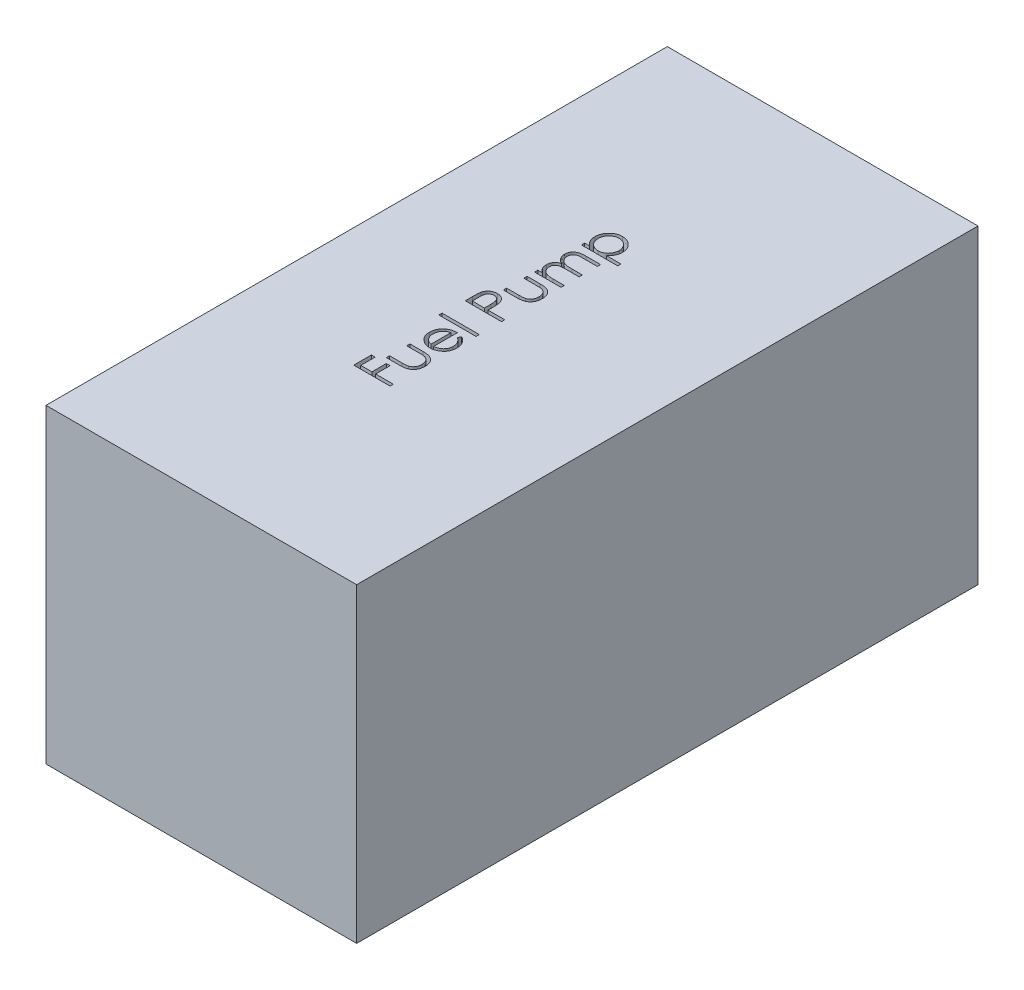
from build123d import *

# Parameters (mm, degrees)
SKETCH1_W           = 30
SKETCH1_H           = 60
BOSS_EXTRUDE1_DEPTH = 30
SKETCH2_W           = 3.58974359
SKETCH2_H           = 0.314102565
CUT_EXTRUDE1_DEPTH  = 2


with BuildPart() as part:
    # Sketch1 → Boss-Extrude1 (new body)
    with BuildSketch(Plane(origin=(0, 0, 0), x_dir=(1, 0, 0), z_dir=(0, 1, 0))):
        Rectangle(SKETCH1_W, SKETCH1_H)
    extrude(amount=BOSS_EXTRUDE1_DEPTH)

    # Sketch2 → Cut-Extrude1 (cut)
    # profile 1 of 8: a face of its own
    with BuildSketch(Plane(origin=(0, 30, 0), x_dir=(1, 0, 0), z_dir=(0, 1, 0))):
        Polygon((-3.5, -11.778846154), (-3.5, -10.073717949), (-3.141025641, -10.073717949), (-3.141025641, -11.46474359), (-2.064102564, -11.46474359), (-2.064102564, -10.073717949), (-1.705128205, -10.073717949), (-1.705128205, -11.46474359), (0, -11.46474359), (0, -11.778846154), align=None)
    # profile 2 of 8: a face of its own
    with BuildSketch(Plane(origin=(0, 30, 0), x_dir=(1, 0, 0), z_dir=(0, 1, 0))):
        with BuildLine():
            Line((-2.557692308, -9.580128205), (-2.557692308, -9.266025641))
            Line((-2.557692308, -9.266025641), (-1.371394231, -9.266025641))
            add(Edge.make_bspline(
                [(-1.371394231, -9.266025641), (-1.336571482, -9.265883736), (-1.269957194, -9.265612279), (-1.174102007, -9.263771338), (-1.086685294, -9.259441244), (-1.007656557, -9.25402742), (-0.937029166, -9.247065284), (-0.875049809, -9.238781923), (-0.821015625, -9.229523501), (-0.788472269, -9.220460787), (-0.77333734, -9.216245994)],
                knots=[0, 0, 0, 0, 1.388932606, 2.656963016, 3.823490214, 4.879454478, 5.816252168, 6.653371382, 7.373723809, 8, 8, 8, 8], degree=3))
            add(Edge.make_bspline(
                [(-0.77333734, -9.216245994), (-0.754314469, -9.209484539), (-0.716664208, -9.196102198), (-0.662275202, -9.171828714), (-0.61189992, -9.141800377), (-0.563595847, -9.108940549), (-0.51879386, -9.071041142), (-0.477569617, -9.028581671), (-0.438365526, -8.982983434), (-0.391980734, -8.91522841), (-0.342265403, -8.822569144), (-0.299369585, -8.700916389), (-0.273733765, -8.569012163), (-0.27075951, -8.477847444), (-0.269230769, -8.430989583)],
                knots=[0, 0, 0, 0, 0.725840625, 1.436591201, 2.137033971, 2.831655856, 3.53531722, 4.242432219, 4.957935707, 5.694543706, 7.190802206, 8.724350549, 10.316345118, 12, 12, 12, 12], degree=3))
            add(Edge.make_bspline(
                [(-0.269230769, -8.430989583), (-0.270792018, -8.384136076), (-0.273812745, -8.293483207), (-0.298596284, -8.163028238), (-0.340001973, -8.043776824), (-0.397809384, -7.936925872), (-0.468551447, -7.842960032), (-0.551560256, -7.764655613), (-0.644209643, -7.700048359), (-0.713333922, -7.671838938), (-0.748096955, -7.657652244)],
                knots=[0, 0, 0, 0, 1.157059328, 2.238695713, 3.266970494, 4.264342957, 5.228770407, 6.160125903, 7.074715775, 8, 8, 8, 8], degree=3))
            add(Edge.make_bspline(
                [(-0.748096955, -7.657652244), (-0.762063254, -7.653458014), (-0.792939329, -7.644185595), (-0.845319078, -7.634223244), (-0.907783682, -7.625248782), (-0.980741891, -7.617585606), (-1.064003043, -7.612120443), (-1.157541119, -7.609174417), (-1.26106248, -7.605846142), (-1.333530239, -7.605795625), (-1.371394231, -7.605769231)],
                knots=[0, 0, 0, 0, 0.557542046, 1.232589297, 2.036731608, 2.971723315, 4.038036528, 5.22795436, 6.551621927, 8, 8, 8, 8], degree=3))
            Line((-1.371394231, -7.605769231), (-2.557692308, -7.605769231))
            Line((-2.557692308, -7.605769231), (-2.557692308, -7.291666667))
            Line((-2.557692308, -7.291666667), (-1.3125, -7.291666667))
            add(Edge.make_bspline(
                [(-1.3125, -7.291666667), (-1.270193064, -7.292109949), (-1.188111822, -7.292969976), (-1.068824502, -7.298455731), (-0.957442487, -7.307999326), (-0.854306526, -7.322110744), (-0.759392664, -7.339230604), (-0.672668679, -7.360876252), (-0.594021821, -7.386867957), (-0.522278152, -7.416169037), (-0.457236046, -7.450796165), (-0.395483334, -7.487606735), (-0.338652658, -7.530191556), (-0.283669926, -7.574635995), (-0.234378406, -7.625237578), (-0.186871763, -7.678103549), (-0.144191351, -7.736140561), (-0.104921928, -7.79766401), (-0.069707159, -7.863253381), (-0.038720643, -7.932749084), (-0.012916197, -8.006431077), (0.008115437, -8.084272146), (0.024914963, -8.165969545), (0.036677563, -8.251688957), (0.043909547, -8.341353275), (0.04454566, -8.402463056), (0.044871795, -8.433794071)],
                knots=[0, 0, 0, 0, 1.493202592, 2.897017285, 4.213619731, 5.437335819, 6.569830554, 7.616136122, 8.589086983, 9.491357706, 10.347307, 11.187612773, 12.025729508, 12.851620453, 13.679855991, 14.515574443, 15.358588344, 16.218977568, 17.089938093, 17.983570823, 18.901874366, 19.842360053, 20.827541903, 21.843594624, 22.894409941, 24, 24, 24, 24], degree=3))
            add(Edge.make_bspline(
                [(0.044871795, -8.433794071), (0.044532563, -8.46489075), (0.043865941, -8.52599862), (0.036717408, -8.615667522), (0.024933365, -8.701624533), (0.007992445, -8.783515079), (-0.01276337, -8.861669227), (-0.038879827, -8.935707544), (-0.069703446, -9.005723525), (-0.104768555, -9.071867815), (-0.144263669, -9.133920969), (-0.187732462, -9.191743513), (-0.234040785, -9.246366275), (-0.284767972, -9.296272997), (-0.339534233, -9.341829725), (-0.398093467, -9.383233962), (-0.45978383, -9.421193883), (-0.525848019, -9.455545787), (-0.598419733, -9.485057798), (-0.678716919, -9.511112967), (-0.767619409, -9.532423629), (-0.865051346, -9.54976609), (-0.970546385, -9.563717533), (-1.084714801, -9.573403674), (-1.207278493, -9.578819505), (-1.291928383, -9.579682567), (-1.335637019, -9.580128205)],
                knots=[0, 0, 0, 0, 1.083759936, 2.129689164, 3.133164553, 4.10615121, 5.04285688, 5.949793092, 6.839814394, 7.707177441, 8.556916231, 9.400895077, 10.227072161, 11.05083587, 11.877976332, 12.707560346, 13.548664154, 14.401248865, 15.299878211, 16.27626931, 17.341250723, 18.483766318, 19.724630785, 21.049282549, 22.476408703, 24, 24, 24, 24], degree=3))
            Line((-1.335637019, -9.580128205), (-2.557692308, -9.580128205))
        make_face()
    # profile 3 of 8: a face of its own
    with BuildSketch(Plane(origin=(0, 30, 0), x_dir=(1, 0, 0), z_dir=(0, 1, 0))):
        with BuildLine():
            Line((-0.807692308, -4.474559295), (-0.661157853, -4.195512821))
            add(Edge.make_bspline(
                [(-0.661157853, -4.195512821), (-0.621723871, -4.217761082), (-0.54500096, -4.261047387), (-0.439586991, -4.33518431), (-0.345319457, -4.413612777), (-0.26370785, -4.498719055), (-0.191634668, -4.587938531), (-0.129467518, -4.682965762), (-0.07608468, -4.783025098), (-0.032342426, -4.889218642), (0.002045853, -5.001419185), (0.027441832, -5.120277795), (0.042169086, -5.246355677), (0.043956532, -5.332693639), (0.044871795, -5.376903045)],
                knots=[0, 0, 0, 0, 1.120611642, 2.180266485, 3.186550691, 4.152466804, 5.095166165, 6.022949561, 6.960161436, 7.899497276, 8.862391909, 9.862399089, 10.905440174, 12, 12, 12, 12], degree=3))
            add(Edge.make_bspline(
                [(0.044871795, -5.376903045), (0.04372462, -5.426045022), (0.041486813, -5.521906784), (0.022194349, -5.661446532), (-0.009278012, -5.792825946), (-0.053243547, -5.916037664), (-0.110670893, -6.030779864), (-0.180630295, -6.137280915), (-0.26276285, -6.236099699), (-0.357778154, -6.324126724), (-0.459464338, -6.40336016), (-0.565404947, -6.47332374), (-0.675233097, -6.531543469), (-0.788295336, -6.579625448), (-0.90433474, -6.617553019), (-1.024015882, -6.644504935), (-1.146864189, -6.659898084), (-1.229959798, -6.662267498), (-1.271834936, -6.663461538)],
                knots=[0, 0, 0, 0, 1.14524686, 2.234044844, 3.276713788, 4.290115724, 5.276966211, 6.260758605, 7.254862358, 8.264742877, 9.274005885, 10.257798278, 11.220590477, 12.167824544, 13.118936889, 14.062732937, 15.023735098, 16, 16, 16, 16], degree=3))
            add(Edge.make_bspline(
                [(-1.271834936, -6.663461538), (-1.311129766, -6.662402397), (-1.389006931, -6.660303319), (-1.504272476, -6.647072531), (-1.616300928, -6.623624238), (-1.725185376, -6.591447914), (-1.83074351, -6.549896668), (-1.933039574, -6.499064449), (-2.031964713, -6.438872071), (-2.094367847, -6.392399398), (-2.125801282, -6.368990385)],
                knots=[0, 0, 0, 0, 1.024358464, 2.0301432, 3.019427413, 4.004406732, 4.986367066, 5.972626655, 6.978780325, 8, 8, 8, 8], degree=3))
            add(Edge.make_bspline(
                [(-2.125801282, -6.368990385), (-2.163732941, -6.337337365), (-2.238272838, -6.275135689), (-2.335322662, -6.168838928), (-2.418340489, -6.055289148), (-2.486066597, -5.933344174), (-2.538158683, -5.803209415), (-2.575211094, -5.665556097), (-2.598266796, -5.520003748), (-2.601109889, -5.420226021), (-2.602564103, -5.369190705)],
                knots=[0, 0, 0, 0, 1.030811313, 2.025658015, 2.997072178, 3.962767568, 4.930766827, 5.917075773, 6.934604948, 8, 8, 8, 8], degree=3))
            add(Edge.make_bspline(
                [(-2.602564103, -5.369190705), (-2.601216835, -5.316740084), (-2.598573804, -5.213843922), (-2.573851652, -5.063854411), (-2.535122917, -4.921652505), (-2.478696987, -4.788411723), (-2.408753193, -4.662079022), (-2.320347513, -4.545561933), (-2.218020567, -4.435661989), (-2.13924476, -4.371760104), (-2.099158654, -4.339242788)],
                knots=[0, 0, 0, 0, 1.056389096, 2.072394598, 3.055233004, 4.020130009, 4.981825462, 5.957811105, 6.960805292, 8, 8, 8, 8], degree=3))
            add(Edge.make_bspline(
                [(-2.099158654, -4.339242788), (-2.068955072, -4.31711585), (-2.008748954, -4.273009257), (-1.910577797, -4.217762157), (-1.807867202, -4.169804762), (-1.698956905, -4.131471801), (-1.585137325, -4.1004323), (-1.46559478, -4.077975481), (-1.340364869, -4.064805863), (-1.255038314, -4.062217165), (-1.211538462, -4.060897436)],
                knots=[0, 0, 0, 0, 0.94817472, 1.890038105, 2.849395472, 3.817997239, 4.812318967, 5.836947057, 6.897266129, 8, 8, 8, 8], degree=3))
            Line((-1.211538462, -4.060897436), (-1.211538462, -6.349358974))
            add(Edge.make_bspline(
                [(-1.211538462, -6.349358974), (-1.177837997, -6.347819368), (-1.111567394, -6.344791794), (-1.01459661, -6.330676651), (-0.922223268, -6.308427877), (-0.835140226, -6.277158814), (-0.752210099, -6.239291969), (-0.674048062, -6.192906252), (-0.601010132, -6.137566698), (-0.532442994, -6.075840999), (-0.471382233, -6.007133904), (-0.416730457, -5.934851156), (-0.37092486, -5.857957591), (-0.33374497, -5.777059508), (-0.304638654, -5.692287723), (-0.284770834, -5.603615528), (-0.271463727, -5.511217411), (-0.269984061, -5.448231677), (-0.269230769, -5.416165865)],
                knots=[0, 0, 0, 0, 1.094153842, 2.151609401, 3.174256925, 4.172055639, 5.149267565, 6.128595816, 7.11444997, 8.118368179, 9.117203808, 10.09244225, 11.054858984, 12.015122123, 12.976791628, 13.957293641, 14.960065497, 16, 16, 16, 16], degree=3))
            add(Edge.make_bspline(
                [(-0.269230769, -5.416165865), (-0.269833929, -5.38481335), (-0.271030715, -5.322603945), (-0.282834755, -5.229983238), (-0.301543133, -5.138702418), (-0.328488888, -5.049667878), (-0.360042003, -4.964177185), (-0.397179816, -4.884570767), (-0.439521127, -4.81190106), (-0.487636723, -4.743716724), (-0.546687196, -4.677939317), (-0.61966842, -4.611654808), (-0.707408148, -4.542149083), (-0.773006325, -4.497937047), (-0.807692308, -4.474559295)],
                knots=[0, 0, 0, 0, 0.991168677, 1.966668791, 2.94808785, 3.9350306, 4.905702032, 5.828266021, 6.709360349, 7.562606342, 8.463112863, 9.498839253, 10.677475166, 12, 12, 12, 12], degree=3))
        make_face()
        with BuildLine():
            add(Edge.make_bspline(
                [(-1.525641026, -4.375), (-1.567324719, -4.386450068), (-1.647343869, -4.408430479), (-1.75811233, -4.455241584), (-1.857124106, -4.506689633), (-1.942733842, -4.568622961), (-2.018888471, -4.638109778), (-2.084375044, -4.719480522), (-2.144732764, -4.809206049), (-2.194996376, -4.909073511), (-2.236300966, -5.015144632), (-2.266672607, -5.125239233), (-2.284525968, -5.23843517), (-2.287143515, -5.314675377), (-2.288461538, -5.353064904)],
                knots=[0, 0, 0, 0, 1.155085888, 2.217389643, 3.210301801, 4.133263417, 5.03575695, 5.95948047, 6.920061569, 7.923798377, 8.943125483, 9.960783337, 10.973185325, 12, 12, 12, 12], degree=3))
            add(Edge.make_bspline(
                [(-2.288461538, -5.353064904), (-2.287857, -5.384416738), (-2.286661954, -5.446392723), (-2.275088768, -5.537659178), (-2.256491944, -5.625534511), (-2.229148178, -5.709756417), (-2.195876219, -5.790883571), (-2.154978249, -5.868857351), (-2.105531888, -5.942675392), (-2.067760071, -5.988811563), (-2.048677885, -6.012119391)],
                knots=[0, 0, 0, 0, 1.048823158, 2.073302879, 3.073550078, 4.050623576, 5.03253758, 6.005186856, 6.992227572, 8, 8, 8, 8], degree=3))
            add(Edge.make_bspline(
                [(-2.048677885, -6.012119391), (-2.033585155, -6.028815289), (-2.00304115, -6.062603718), (-1.950387182, -6.107703406), (-1.893576633, -6.151206796), (-1.83012967, -6.189865896), (-1.761886187, -6.226605633), (-1.688348228, -6.260085058), (-1.609205387, -6.290526103), (-1.554028674, -6.307614505), (-1.525641026, -6.31640625)],
                knots=[0, 0, 0, 0, 0.879905587, 1.780714457, 2.708106151, 3.677566983, 4.684151534, 5.740052498, 6.837288539, 8, 8, 8, 8], degree=3))
            Line((-1.525641026, -6.31640625), (-1.525641026, -4.375))
        make_face(mode=Mode.SUBTRACT)
    # profile 4 of 8: a face of its own
    with BuildSketch(Plane(origin=(0, 30, 0), x_dir=(1, 0, 0), z_dir=(0, 1, 0))):
        with Locations((-1.794871795, -3.320512821)):
            Rectangle(SKETCH2_W, SKETCH2_H)
    # profile 5 of 8: a face of its own
    with BuildSketch(Plane(origin=(0, 30, 0), x_dir=(1, 0, 0), z_dir=(0, 1, 0))):
        with BuildLine():
            Line((-3.5, -1.009615385), (-3.5, -0.323217147))
            add(Edge.make_bspline(
                [(-3.5, -0.323217147), (-3.499948104, -0.276006241), (-3.499848668, -0.185548048), (-3.496833922, -0.055832993), (-3.49280723, 0.061976739), (-3.487225337, 0.16762712), (-3.480628747, 0.261443218), (-3.471376708, 0.343000517), (-3.461716412, 0.412940074), (-3.451895005, 0.454846523), (-3.447415865, 0.473958333)],
                knots=[0, 0, 0, 0, 1.415646017, 2.712440637, 3.8905458, 4.950247383, 5.884950622, 6.709939814, 7.411656543, 8, 8, 8, 8], degree=3))
            add(Edge.make_bspline(
                [(-3.447415865, 0.473958333), (-3.440793656, 0.498151656), (-3.427705283, 0.545968216), (-3.401495308, 0.614872313), (-3.370399226, 0.680414824), (-3.335026736, 0.742888284), (-3.293636643, 0.801154838), (-3.248982453, 0.857156834), (-3.198178423, 0.908917405), (-3.142826928, 0.957137642), (-3.083629995, 1.001706269), (-3.019512093, 1.039151975), (-2.952387489, 1.071893333), (-2.881343905, 1.098700345), (-2.806312365, 1.118635153), (-2.727826093, 1.133434739), (-2.645796833, 1.142871502), (-2.589736211, 1.143772239), (-2.561197917, 1.144230769)],
                knots=[0, 0, 0, 0, 0.999549623, 1.97554611, 2.93413192, 3.889860808, 4.833293765, 5.780583482, 6.742559327, 7.719844669, 8.705620613, 9.691528643, 10.674968152, 11.680406189, 12.713313868, 13.765869198, 14.862690416, 16, 16, 16, 16], degree=3))
            add(Edge.make_bspline(
                [(-2.561197917, 1.144230769), (-2.53242014, 1.143809345), (-2.476114476, 1.142984799), (-2.393741688, 1.133088513), (-2.315023298, 1.119758322), (-2.240133847, 1.099261269), (-2.169518077, 1.072415596), (-2.102096845, 1.040923543), (-2.039017173, 1.002940013), (-1.980050055, 0.959295183), (-1.925140143, 0.910743589), (-1.874685348, 0.857490651), (-1.82898101, 0.799751358), (-1.787924666, 0.73770921), (-1.752468387, 0.670759361), (-1.720711082, 0.599917208), (-1.694040021, 0.524566991), (-1.68000996, 0.472424477), (-1.672876603, 0.445913462)],
                knots=[0, 0, 0, 0, 1.121902311, 2.195077645, 3.232258892, 4.234102512, 5.217864754, 6.176164875, 7.132989551, 8.084763148, 9.034132444, 9.988522005, 10.94243251, 11.903244335, 12.886203696, 13.894208494, 14.929344452, 16, 16, 16, 16], degree=3))
            add(Edge.make_bspline(
                [(-1.672876603, 0.445913462), (-1.668217097, 0.423985878), (-1.658005519, 0.375930303), (-1.646527991, 0.296792544), (-1.637115164, 0.204605921), (-1.628331038, 0.099684096), (-1.62367655, -0.018217607), (-1.618211422, -0.148828778), (-1.615632726, -0.29259145), (-1.615469721, -0.392861431), (-1.615384615, -0.44521234)],
                knots=[0, 0, 0, 0, 0.601372724, 1.317943291, 2.144091499, 3.08771165, 4.142394186, 5.309582461, 6.595334295, 8, 8, 8, 8], degree=3))
            Line((-1.615384615, -0.44521234), (-1.615384615, -0.695512821))
            Line((-1.615384615, -0.695512821), (0, -0.695512821))
            Line((0, -0.695512821), (0, -1.009615385))
            Line((0, -1.009615385), (-3.5, -1.009615385))
        make_face()
        with BuildLine():
            Line((-3.141025641, -0.695512821), (-1.974358974, -0.695512821))
            Line((-1.974358974, -0.695512821), (-1.966646635, -0.082732372))
            add(Edge.make_bspline(
                [(-1.966646635, -0.082732372), (-1.966630159, -0.052812237), (-1.966598354, 0.004947967), (-1.970597112, 0.088381392), (-1.975151713, 0.165800176), (-1.982040283, 0.236913191), (-1.991070108, 0.30196996), (-2.002299597, 0.360408551), (-2.014507839, 0.413103008), (-2.034904783, 0.473717772), (-2.066267176, 0.541850764), (-2.111922136, 0.616280858), (-2.171065957, 0.678871031), (-2.237378684, 0.732934192), (-2.31095019, 0.776681238), (-2.390081368, 0.807543034), (-2.473599899, 0.826546454), (-2.530715065, 0.828919799), (-2.559795673, 0.830128205)],
                knots=[0, 0, 0, 0, 1.160746174, 2.240796558, 3.240300023, 4.169675897, 5.012224395, 5.787635701, 6.478238024, 7.109103438, 8.265591281, 9.382545711, 10.479929969, 11.588830844, 12.694575677, 13.785760505, 14.872603606, 16, 16, 16, 16], degree=3))
            add(Edge.make_bspline(
                [(-2.559795673, 0.830128205), (-2.587934159, 0.828865546), (-2.643869987, 0.826355536), (-2.725849153, 0.807699858), (-2.80408331, 0.77634984), (-2.877062333, 0.732895946), (-2.943229146, 0.680144814), (-3.000805895, 0.618881685), (-3.046782313, 0.548949828), (-3.077600441, 0.484439345), (-3.095643367, 0.426671001), (-3.108675115, 0.376741191), (-3.117661404, 0.320076696), (-3.126260161, 0.257215915), (-3.133201074, 0.188238658), (-3.138021109, 0.112706524), (-3.140812422, 0.03087104), (-3.140952847, -0.025939264), (-3.141025641, -0.055388622)],
                knots=[0, 0, 0, 0, 1.120540835, 2.227496496, 3.330685923, 4.466139262, 5.598993257, 6.692710361, 7.80064471, 8.921224235, 9.527843361, 10.209888745, 10.975318552, 11.811557897, 12.738105936, 13.73658638, 14.826690375, 16, 16, 16, 16], degree=3))
            Line((-3.141025641, -0.055388622), (-3.141025641, -0.695512821))
        make_face(mode=Mode.SUBTRACT)
    # profile 6 of 8: a face of its own
    with BuildSketch(Plane(origin=(0, 30, 0), x_dir=(1, 0, 0), z_dir=(0, 1, 0))):
        with BuildLine():
            Line((-2.557692308, 1.727564103), (-2.557692308, 2.041666667))
            Line((-2.557692308, 2.041666667), (-1.371394231, 2.041666667))
            add(Edge.make_bspline(
                [(-1.371394231, 2.041666667), (-1.336571482, 2.041808572), (-1.269957194, 2.042080029), (-1.174102007, 2.04392097), (-1.086685294, 2.048251064), (-1.007656557, 2.053664888), (-0.937029166, 2.060627024), (-0.875049809, 2.068910385), (-0.821015625, 2.078168806), (-0.788472269, 2.08723152), (-0.77333734, 2.091446314)],
                knots=[0, 0, 0, 0, 1.388932606, 2.656963016, 3.823490214, 4.879454478, 5.816252168, 6.653371382, 7.373723809, 8, 8, 8, 8], degree=3))
            add(Edge.make_bspline(
                [(-0.77333734, 2.091446314), (-0.754314469, 2.098207769), (-0.716664208, 2.11159011), (-0.662275202, 2.135863594), (-0.61189992, 2.16589193), (-0.563595847, 2.198751758), (-0.51879386, 2.236651166), (-0.477569617, 2.279110637), (-0.438365526, 2.324708874), (-0.391980734, 2.392463897), (-0.342265403, 2.485123163), (-0.299369585, 2.606775919), (-0.273733765, 2.738680145), (-0.27075951, 2.829844864), (-0.269230769, 2.876702724)],
                knots=[0, 0, 0, 0, 0.725840625, 1.436591201, 2.137033971, 2.831655856, 3.53531722, 4.242432219, 4.957935707, 5.694543706, 7.190802206, 8.724350549, 10.316345118, 12, 12, 12, 12], degree=3))
            add(Edge.make_bspline(
                [(-0.269230769, 2.876702724), (-0.270792018, 2.923556232), (-0.273812745, 3.0142091), (-0.298596284, 3.14466407), (-0.340001973, 3.263915484), (-0.397809384, 3.370766435), (-0.468551447, 3.464732276), (-0.551560256, 3.543036694), (-0.644209643, 3.607643949), (-0.713333922, 3.63585337), (-0.748096955, 3.650040064)],
                knots=[0, 0, 0, 0, 1.157059328, 2.238695713, 3.266970494, 4.264342957, 5.228770407, 6.160125903, 7.074715775, 8, 8, 8, 8], degree=3))
            add(Edge.make_bspline(
                [(-0.748096955, 3.650040064), (-0.762063254, 3.654234294), (-0.792939329, 3.663506713), (-0.845319078, 3.673469064), (-0.907783682, 3.682443526), (-0.980741891, 3.690106702), (-1.064003043, 3.695571864), (-1.157541119, 3.698517891), (-1.26106248, 3.701846166), (-1.333530239, 3.701896682), (-1.371394231, 3.701923077)],
                knots=[0, 0, 0, 0, 0.557542046, 1.232589297, 2.036731608, 2.971723315, 4.038036528, 5.22795436, 6.551621927, 8, 8, 8, 8], degree=3))
            Line((-1.371394231, 3.701923077), (-2.557692308, 3.701923077))
            Line((-2.557692308, 3.701923077), (-2.557692308, 4.016025641))
            Line((-2.557692308, 4.016025641), (-1.3125, 4.016025641))
            add(Edge.make_bspline(
                [(-1.3125, 4.016025641), (-1.270193064, 4.015582359), (-1.188111822, 4.014722332), (-1.068824502, 4.009236577), (-0.957442487, 3.999692982), (-0.854306526, 3.985581564), (-0.759392664, 3.968461704), (-0.672668679, 3.946816056), (-0.594021821, 3.92082435), (-0.522278152, 3.89152327), (-0.457236046, 3.856896143), (-0.395483334, 3.820085573), (-0.338652658, 3.777500752), (-0.283669926, 3.733056312), (-0.234378406, 3.682454729), (-0.186871763, 3.629588759), (-0.144191351, 3.571551747), (-0.104921928, 3.510028297), (-0.069707159, 3.444438927), (-0.038720643, 3.374943224), (-0.012916197, 3.301261231), (0.008115437, 3.223420162), (0.024914963, 3.141722763), (0.036677563, 3.056003351), (0.043909547, 2.966339033), (0.04454566, 2.905229251), (0.044871795, 2.873898237)],
                knots=[0, 0, 0, 0, 1.493202592, 2.897017285, 4.213619731, 5.437335819, 6.569830554, 7.616136122, 8.589086983, 9.491357706, 10.347307, 11.187612773, 12.025729508, 12.851620453, 13.679855991, 14.515574443, 15.358588344, 16.218977568, 17.089938093, 17.983570823, 18.901874366, 19.842360053, 20.827541903, 21.843594624, 22.894409941, 24, 24, 24, 24], degree=3))
            add(Edge.make_bspline(
                [(0.044871795, 2.873898237), (0.044532563, 2.842801558), (0.043865941, 2.781693687), (0.036717408, 2.692024785), (0.024933365, 2.606067775), (0.007992445, 2.524177228), (-0.01276337, 2.446023081), (-0.038879827, 2.371984764), (-0.069703446, 2.301968783), (-0.104768555, 2.235824492), (-0.144263669, 2.173771338), (-0.187732462, 2.115948794), (-0.234040785, 2.061326033), (-0.284767972, 2.011419311), (-0.339534233, 1.965862583), (-0.398093467, 1.924458346), (-0.45978383, 1.886498425), (-0.525848019, 1.852146521), (-0.598419733, 1.82263451), (-0.678716919, 1.796579341), (-0.767619409, 1.775268679), (-0.865051346, 1.757926218), (-0.970546385, 1.743974775), (-1.084714801, 1.734288633), (-1.207278493, 1.728872802), (-1.291928383, 1.728009741), (-1.335637019, 1.727564103)],
                knots=[0, 0, 0, 0, 1.083759936, 2.129689164, 3.133164553, 4.10615121, 5.04285688, 5.949793092, 6.839814394, 7.707177441, 8.556916231, 9.400895077, 10.227072161, 11.05083587, 11.877976332, 12.707560346, 13.548664154, 14.401248865, 15.299878211, 16.27626931, 17.341250723, 18.483766318, 19.724630785, 21.049282549, 22.476408703, 24, 24, 24, 24], degree=3))
            Line((-1.335637019, 1.727564103), (-2.557692308, 1.727564103))
        make_face()
    # profile 7 of 8: a face of its own
    with BuildSketch(Plane(origin=(0, 30, 0), x_dir=(1, 0, 0), z_dir=(0, 1, 0))):
        with BuildLine():
            Line((-2.557692308, 4.733974359), (-2.557692308, 5.048076923))
            Line((-2.557692308, 5.048076923), (-2.11318109, 5.048076923))
            add(Edge.make_bspline(
                [(-2.11318109, 5.048076923), (-2.152068691, 5.076360873), (-2.226581065, 5.130555633), (-2.324771349, 5.219421285), (-2.408099503, 5.308197398), (-2.451842375, 5.372130779), (-2.472856571, 5.402844551)],
                knots=[0, 0, 0, 0, 1.134379233, 2.173579362, 3.122582517, 4, 4, 4, 4], degree=3))
            add(Edge.make_bspline(
                [(-2.472856571, 5.402844551), (-2.492861936, 5.444709213), (-2.532523149, 5.527707113), (-2.572756708, 5.659126338), (-2.597481809, 5.793601008), (-2.600863183, 5.884409222), (-2.602564103, 5.930088141)],
                knots=[0, 0, 0, 0, 1.014936303, 2.012140481, 3.000054389, 4, 4, 4, 4], degree=3))
            add(Edge.make_bspline(
                [(-2.602564103, 5.930088141), (-2.601518795, 5.960981121), (-2.599450189, 6.022116668), (-2.585990392, 6.112700997), (-2.562723318, 6.200558707), (-2.530319354, 6.2851761), (-2.491060437, 6.364884533), (-2.445053708, 6.438016767), (-2.393306724, 6.503356111), (-2.334333793, 6.561949753), (-2.264862316, 6.614174805), (-2.183559964, 6.6618778), (-2.08925491, 6.706541209), (-2.020875846, 6.73113989), (-1.984875801, 6.744090545)],
                knots=[0, 0, 0, 0, 1.009731074, 1.9982035, 2.985760524, 3.974587072, 4.955028184, 5.885388378, 6.793242796, 7.673688873, 8.594941726, 9.625945874, 10.750113716, 12, 12, 12, 12], degree=3))
            add(Edge.make_bspline(
                [(-1.984875801, 6.744090545), (-2.009599951, 6.757802047), (-2.058253607, 6.784784357), (-2.127115714, 6.830086412), (-2.191508463, 6.877567293), (-2.251565242, 6.92755487), (-2.306807989, 6.980259077), (-2.358363703, 7.034830735), (-2.404804507, 7.092491939), (-2.459144427, 7.1722484), (-2.517049043, 7.275909795), (-2.5659883, 7.407117044), (-2.597155199, 7.543084969), (-2.600749221, 7.635516271), (-2.602564103, 7.682191506)],
                knots=[0, 0, 0, 0, 0.861026002, 1.694378253, 2.508904292, 3.297437177, 4.073006284, 4.833627155, 5.583069468, 6.325614666, 7.772320565, 9.187282923, 10.579656144, 12, 12, 12, 12], degree=3))
            add(Edge.make_bspline(
                [(-2.602564103, 7.682191506), (-2.600967141, 7.725080421), (-2.597841733, 7.80901819), (-2.572719073, 7.931010678), (-2.531138774, 8.045268189), (-2.472663924, 8.150579711), (-2.399531394, 8.245721513), (-2.312414829, 8.328736543), (-2.211632405, 8.397799542), (-2.117579812, 8.443970045), (-2.034389392, 8.474706422), (-1.963185215, 8.493902535), (-1.884752788, 8.510533357), (-1.799155195, 8.524633785), (-1.706219128, 8.534827749), (-1.605901886, 8.542405823), (-1.498116296, 8.547527741), (-1.423750864, 8.547890122), (-1.385416667, 8.548076923)],
                knots=[0, 0, 0, 0, 1.209392158, 2.366897878, 3.497663982, 4.628180075, 5.751982922, 6.871462727, 8.009245026, 9.185977379, 9.818124946, 10.509294143, 11.264649411, 12.079922034, 12.956003306, 13.901808055, 14.918415426, 16, 16, 16, 16], degree=3))
            Line((-1.385416667, 8.548076923), (0, 8.548076923))
            Line((0, 8.548076923), (0, 8.233974359))
            Line((0, 8.233974359), (-1.38681891, 8.233974359))
            add(Edge.make_bspline(
                [(-1.38681891, 8.233974359), (-1.419539532, 8.233896854), (-1.482423592, 8.233747901), (-1.572675409, 8.231049299), (-1.654945859, 8.225990401), (-1.729342325, 8.219984288), (-1.795841461, 8.211865749), (-1.854257043, 8.201146747), (-1.9048556, 8.189881199), (-1.960925892, 8.171121066), (-2.022726969, 8.141408587), (-2.088890354, 8.095325827), (-2.146933879, 8.03813608), (-2.197324223, 7.971735321), (-2.238325656, 7.896198186), (-2.267599493, 7.812930309), (-2.285722976, 7.722467135), (-2.287528906, 7.659844222), (-2.288461538, 7.627504006)],
                knots=[0, 0, 0, 0, 1.253367865, 2.408782419, 3.458086102, 4.410454771, 5.267690823, 6.022776742, 6.685072793, 7.251272234, 8.28433411, 9.300106008, 10.325693114, 11.39283262, 12.482417211, 13.60372085, 14.762494729, 16, 16, 16, 16], degree=3))
            add(Edge.make_bspline(
                [(-2.288461538, 7.627504006), (-2.286650234, 7.587866405), (-2.283073601, 7.509597326), (-2.256183457, 7.394676764), (-2.21149058, 7.285418126), (-2.150365715, 7.182559066), (-2.075277643, 7.088810351), (-1.986421859, 7.007861806), (-1.885766471, 6.941042616), (-1.792625999, 6.89578641), (-1.708955957, 6.867195099), (-1.63585754, 6.848327361), (-1.552553658, 6.833562327), (-1.460021107, 6.819982952), (-1.357471972, 6.810818488), (-1.245539461, 6.802722691), (-1.123457335, 6.798885213), (-1.03883038, 6.798353164), (-0.994891827, 6.798076923)],
                knots=[0, 0, 0, 0, 1.091136677, 2.154576964, 3.231646693, 4.331257757, 5.439166191, 6.528231045, 7.628049365, 8.756709726, 9.369482423, 10.061167346, 10.833871401, 11.698739631, 12.636505159, 13.668922441, 14.789697963, 16, 16, 16, 16], degree=3))
            Line((-0.994891827, 6.798076923), (0, 6.798076923))
            Line((0, 6.798076923), (0, 6.483974359))
            Line((0, 6.483974359), (-1.300580929, 6.483974359))
            add(Edge.make_bspline(
                [(-1.300580929, 6.483974359), (-1.337274248, 6.483894928), (-1.407868505, 6.48374211), (-1.509102182, 6.481065794), (-1.601183257, 6.475979168), (-1.684004737, 6.470098634), (-1.757416015, 6.461638412), (-1.82181093, 6.452028783), (-1.877027204, 6.44067977), (-1.937592422, 6.421891433), (-2.004301329, 6.393166822), (-2.075490524, 6.347019222), (-2.137685856, 6.289160203), (-2.191603491, 6.222037009), (-2.235661858, 6.145924229), (-2.266282089, 6.061663631), (-2.284963448, 5.970635461), (-2.287273519, 5.907744247), (-2.288461538, 5.875400641)],
                knots=[0, 0, 0, 0, 1.320285835, 2.540097241, 3.643286278, 4.638464947, 5.527188413, 6.301437306, 6.980978976, 7.552872752, 8.580906713, 9.583871393, 10.589652407, 11.624542289, 12.671761011, 13.738681301, 14.837052193, 16, 16, 16, 16], degree=3))
            add(Edge.make_bspline(
                [(-2.288461538, 5.875400641), (-2.286931074, 5.837384439), (-2.283880911, 5.761619499), (-2.256426711, 5.650317386), (-2.21342235, 5.542832259), (-2.153763642, 5.440875402), (-2.07986036, 5.347209421), (-1.992961037, 5.265170892), (-1.894225475, 5.196462484), (-1.802459578, 5.150420493), (-1.720860857, 5.120903032), (-1.651210111, 5.101550424), (-1.574017062, 5.084563842), (-1.489121759, 5.072079843), (-1.39690313, 5.059990394), (-1.296887899, 5.054162802), (-1.189166028, 5.048490445), (-1.114793451, 5.048218145), (-1.076221955, 5.048076923)],
                knots=[0, 0, 0, 0, 1.09880202, 2.189873405, 3.297736452, 4.440485332, 5.596193377, 6.739822772, 7.886349079, 9.066114917, 9.699498033, 10.395421758, 11.156987371, 11.985484089, 12.878178647, 13.847820956, 14.883825601, 16, 16, 16, 16], degree=3))
            Line((-1.076221955, 5.048076923), (0, 5.048076923))
            Line((0, 5.048076923), (0, 4.733974359))
            Line((0, 4.733974359), (-2.557692308, 4.733974359))
        make_face()
    # profile 8 of 8: a face of its own
    with BuildSketch(Plane(origin=(0, 30, 0), x_dir=(1, 0, 0), z_dir=(0, 1, 0))):
        with BuildLine():
            Line((-2.557692308, 9.266025641), (-2.557692308, 9.580128205))
            Line((-2.557692308, 9.580128205), (-2.084435096, 9.580128205))
            add(Edge.make_bspline(
                [(-2.084435096, 9.580128205), (-2.127042337, 9.613581838), (-2.210103827, 9.678798653), (-2.318970963, 9.789502026), (-2.408927714, 9.908442608), (-2.481456368, 10.034870331), (-2.535018123, 10.169587879), (-2.574879734, 10.310669429), (-2.598298713, 10.459722094), (-2.601123494, 10.561616619), (-2.602564103, 10.613581731)],
                knots=[0, 0, 0, 0, 1.07939028, 2.104237756, 3.085658289, 4.045737152, 5.001099604, 5.968961907, 6.964192404, 8, 8, 8, 8], degree=3))
            add(Edge.make_bspline(
                [(-2.602564103, 10.613581731), (-2.601250924, 10.658973334), (-2.598655357, 10.748692222), (-2.581082302, 10.880755451), (-2.55096461, 11.007930835), (-2.507563694, 11.129498889), (-2.453908224, 11.246761954), (-2.386191189, 11.357984054), (-2.307784998, 11.464897609), (-2.217552847, 11.564813798), (-2.119924581, 11.657135166), (-2.014902277, 11.736981347), (-1.90593969, 11.805853251), (-1.791347598, 11.861523548), (-1.672028368, 11.905131895), (-1.547499927, 11.936146573), (-1.418223987, 11.954604216), (-1.330321266, 11.957080668), (-1.285857372, 11.958333333)],
                knots=[0, 0, 0, 0, 1.041296284, 2.058176809, 3.050446431, 4.034000596, 5.01514041, 6.003636468, 7.015969324, 8.052561599, 9.08815499, 10.094063707, 11.074456064, 12.040834395, 13.011057502, 13.983766392, 14.980127149, 16, 16, 16, 16], degree=3))
            add(Edge.make_bspline(
                [(-1.285857372, 11.958333333), (-1.240455063, 11.957107848), (-1.150915159, 11.954691013), (-1.019428062, 11.935946007), (-0.892940688, 11.905989133), (-0.771663424, 11.86293095), (-0.655679773, 11.807289462), (-0.545073377, 11.739584901), (-0.439879674, 11.659698434), (-0.341526774, 11.568397307), (-0.250927461, 11.469344371), (-0.171689391, 11.363466881), (-0.105148016, 11.252407956), (-0.049565056, 11.136735788), (-0.007672872, 11.01546015), (0.022544929, 10.889146872), (0.041179424, 10.757864726), (0.043631567, 10.668563574), (0.044871795, 10.623397436)],
                knots=[0, 0, 0, 0, 1.038740735, 2.04854663, 3.033179607, 4.009277356, 4.987731542, 5.972001279, 6.972200261, 8.005528982, 9.039189865, 10.040446548, 11.026516639, 11.997840187, 12.972163198, 13.956796175, 14.96660207, 16, 16, 16, 16], degree=3))
            add(Edge.make_bspline(
                [(0.044871795, 10.623397436), (0.043476056, 10.572589051), (0.040720109, 10.472265679), (0.016259294, 10.325165279), (-0.02391459, 10.184233388), (-0.080254687, 10.049884084), (-0.152613938, 9.921743168), (-0.240695462, 9.800315926), (-0.344483983, 9.68500122), (-0.423214701, 9.615592178), (-0.463441506, 9.580128205)],
                knots=[0, 0, 0, 0, 1.014661154, 2.003492687, 2.970165371, 3.937187664, 4.907406957, 5.904113462, 6.929124205, 8, 8, 8, 8], degree=3))
            Line((-0.463441506, 9.580128205), (0.942307692, 9.580128205))
            Line((0.942307692, 9.580128205), (0.942307692, 9.266025641))
            Line((0.942307692, 9.266025641), (-2.557692308, 9.266025641))
        make_face()
        with BuildLine():
            add(Edge.make_bspline(
                [(-2.288461538, 10.610777244), (-2.28782128, 10.575197681), (-2.286560777, 10.505150693), (-2.271586828, 10.402478474), (-2.249849087, 10.303583047), (-2.216937187, 10.209461095), (-2.176538373, 10.119210479), (-2.126056362, 10.033526314), (-2.066404356, 9.952468746), (-1.998725013, 9.876241716), (-1.924150324, 9.807378423), (-1.844562515, 9.746415495), (-1.760062376, 9.695208189), (-1.671437013, 9.652706169), (-1.577991728, 9.620362887), (-1.480258715, 9.597407167), (-1.378131003, 9.582976814), (-1.308574996, 9.581087877), (-1.273237179, 9.580128205)],
                knots=[0, 0, 0, 0, 1.05670511, 2.080379991, 3.077984906, 4.06214886, 5.038337365, 6.01289324, 7.01187578, 8.025460281, 9.038092164, 10.024533457, 11.000252242, 11.969694649, 12.940728589, 13.933144304, 14.949937299, 16, 16, 16, 16], degree=3))
            add(Edge.make_bspline(
                [(-1.273237179, 9.580128205), (-1.226850838, 9.581725749), (-1.135976066, 9.584855473), (-1.003385607, 9.610056526), (-0.878026807, 9.651530809), (-0.760715467, 9.710168542), (-0.652178958, 9.783415191), (-0.556123168, 9.873268481), (-0.47128982, 9.976387553), (-0.399835981, 10.092483544), (-0.342108841, 10.21705465), (-0.299475735, 10.346557628), (-0.274171087, 10.480083686), (-0.270886459, 10.570239865), (-0.269230769, 10.615685096)],
                knots=[0, 0, 0, 0, 1.037533453, 2.032615907, 3.008487753, 3.983910949, 4.958815134, 5.928528047, 6.917017829, 7.938835504, 8.970843303, 9.983125212, 10.983349323, 12, 12, 12, 12], degree=3))
            add(Edge.make_bspline(
                [(-0.269230769, 10.615685096), (-0.270787191, 10.660220812), (-0.27387641, 10.748616201), (-0.30061393, 10.878775091), (-0.341461508, 11.005262789), (-0.401011352, 11.125454145), (-0.474037785, 11.23823575), (-0.561578008, 11.340406013), (-0.663735165, 11.42891743), (-0.776729045, 11.505079301), (-0.897782978, 11.565967629), (-1.022806897, 11.61221918), (-1.151778239, 11.638569063), (-1.238770313, 11.642341065), (-1.282351763, 11.644230769)],
                knots=[0, 0, 0, 0, 1.001123591, 1.987050352, 2.978152323, 3.984730168, 4.995502505, 5.994801396, 7.000994558, 8.027767845, 9.053126238, 10.042874082, 11.019515457, 12, 12, 12, 12], degree=3))
            add(Edge.make_bspline(
                [(-1.282351763, 11.644230769), (-1.326206005, 11.642775048), (-1.41357282, 11.639874946), (-1.542346872, 11.611342644), (-1.668191626, 11.568385542), (-1.787705752, 11.506135879), (-1.899860141, 11.431153027), (-2.000175763, 11.342471352), (-2.086347851, 11.240799302), (-2.159432177, 11.128893032), (-2.216486109, 11.007635436), (-2.258445723, 10.880374217), (-2.283599254, 10.747316325), (-2.28682652, 10.656690621), (-2.288461538, 10.610777244)],
                knots=[0, 0, 0, 0, 0.984010603, 1.960354772, 2.950163297, 3.964735994, 4.97843856, 5.975353722, 6.962442164, 7.964544167, 8.969901786, 9.964615439, 10.968820376, 12, 12, 12, 12], degree=3))
        make_face(mode=Mode.SUBTRACT)
    extrude(amount=-CUT_EXTRUDE1_DEPTH, mode=Mode.SUBTRACT)


solid = part.part
